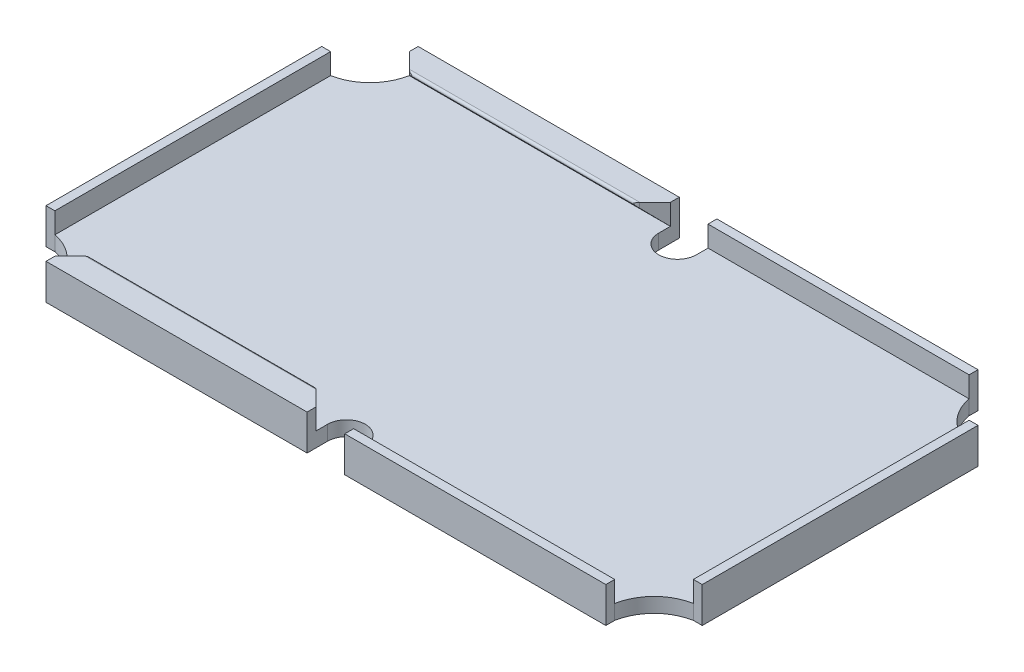
from build123d import *

# Parameters (mm, degrees)
CROQUIS1_W              = 92.4
CROQUIS1_H              = 52.4
SALIENTE_EXTRUIR1_DEPTH = 5
CROQUIS2_W              = 89.9
CROQUIS2_H              = 49.9
CORTAR_EXTRUIR1_DEPTH   = 2.93
CORTAR_EXTRUIR2_START   = -2.07
CORTAR_EXTRUIR2_DEPTH   = 5
CORTAR_EXTRUIR3_START   = -2.07
CORTAR_EXTRUIR3_DEPTH   = 5
SIMETR_A2_START         = -2.07
SIMETR_A2_COPY_1_DEPTH  = 5
SALIENTE_EXTRUIR3_START = -36.764169
SALIENTE_EXTRUIR3_DEPTH = 36.764169
CORTAR_EXTRUIR5_REACH   = 55.193


with BuildPart() as part:
    # Croquis1 → Saliente-Extruir1 (new body)
    with BuildSketch(Plane(origin=(0, 0, 0), x_dir=(1, 0, 0), z_dir=(0, 1, 0))):
        Rectangle(CROQUIS1_W, CROQUIS1_H)
    extrude(amount=SALIENTE_EXTRUIR1_DEPTH)

    # Croquis2 → Cortar-Extruir1 (cut)
    with BuildSketch(Plane(origin=(0, 5, 0), x_dir=(1, 0, 0), z_dir=(0, 1, 0))):
        Rectangle(CROQUIS2_W, CROQUIS2_H)
    extrude(amount=-CORTAR_EXTRUIR1_DEPTH, mode=Mode.SUBTRACT)

    # Croquis3 → Cortar-Extruir2 (cut)
    with BuildSketch(Plane(origin=(0, 2.07, 0), x_dir=(1, 0, 0), z_dir=(0, 1, 0)).offset(CORTAR_EXTRUIR2_START)):
        with BuildLine():
            Line((2.65, -23.31), (2.65, -26.2))
            Line((2.65, -26.2), (-2.65, -26.2))
            Line((-2.65, -26.2), (-2.65, -23.31))
            ThreePointArc((-2.65, -23.31), (0, -20.66), (2.65, -23.31))
        make_face()
    cortar_extruir2 = extrude(amount=CORTAR_EXTRUIR2_DEPTH, mode=Mode.SUBTRACT)

    # Croquis4 → Cortar-Extruir3 (cut)
    with BuildSketch(Plane(origin=(0, 2.07, 0), x_dir=(1, 0, 0), z_dir=(0, 1, 0)).offset(CORTAR_EXTRUIR3_START)):
        with BuildLine():
            Line((-46.2, -19.414169174), (-46.2, -26.2))
            Line((-46.2, -26.2), (-39.414169174, -26.2))
            Line((-39.414169174, -26.2), (-39.414169174, -24.95))
            ThreePointArc((-39.414169174, -24.95), (-41.32096321, -21.32096321), (-44.95, -19.414169174))
            Line((-44.95, -19.414169174), (-46.2, -19.414169174))
        make_face()
    cortar_extruir3 = extrude(amount=CORTAR_EXTRUIR3_DEPTH, mode=Mode.SUBTRACT)

    # Simetría1: Cortar-Extruir3 across plane
    add(cortar_extruir3.mirror(Plane(origin=(0, 0, 0), x_dir=(0, 0, 1), z_dir=(1, 0, 0))), mode=Mode.SUBTRACT)

    # Simetría2: Cortar-Extruir3 across plane
    add(cortar_extruir3.mirror(Plane.XY), mode=Mode.SUBTRACT)

    # Simetría2 copy 1 sketch → Simetría2 copy 1 (cut)
    with BuildSketch(Plane(origin=(0, 2.07, 0), x_dir=(-1, 0, 0), z_dir=(0, 1, 0)).offset(SIMETR_A2_START)):
        with BuildLine():
            Line((-46.2, -19.414169174), (-46.2, -26.2))
            Line((-46.2, -26.2), (-39.414169174, -26.2))
            Line((-39.414169174, -26.2), (-39.414169174, -24.95))
            ThreePointArc((-39.414169174, -24.95), (-41.32096321, -21.32096321), (-44.95, -19.414169174))
            Line((-44.95, -19.414169174), (-46.2, -19.414169174))
        make_face()
    extrude(amount=SIMETR_A2_COPY_1_DEPTH, mode=Mode.SUBTRACT)

    # Simetría3: Cortar-Extruir2 across plane
    add(cortar_extruir2.mirror(Plane.XY), mode=Mode.SUBTRACT)

    # Croquis7 → Saliente-Extruir3 (add)
    with BuildSketch(Plane(origin=(-2.65, 0, 0), x_dir=(0, 0, -1), z_dir=(1, 0, 0)).offset(SALIENTE_EXTRUIR3_START)):
        with BuildLine():
            Line((-24.95, 2.07), (-24.95, 5))
            Line((-24.95, 5), (-22.8, 5))
            ThreePointArc((-22.8, 5), (-22.523509792, 4.816418061), (-22.585410307, 4.490354433))
            Line((-22.585410307, 4.490354433), (-24.95, 2.07))
        make_face()
    saliente_extruir3 = extrude(amount=SALIENTE_EXTRUIR3_DEPTH)

    # Cortar-Extruir5: up to this face of the body (flat: up to its plane)
    cortar_extruir5_end = Plane(part.part.faces().sort_by_distance((21.032084587, 5, 25.575))[0])
    # Croquis8 → Cortar-Extruir5 (cut, up to the picked face)
    with BuildSketch(Plane(origin=(0, 2.07, 0), x_dir=(1, 0, 0), z_dir=(0, 1, 0)), mode=Mode.PRIVATE) as cortar_extruir5_sk1:
        with BuildLine():
            Line((-39.414169174, -24.95), (-37.257062393, -22.792893219))
            ThreePointArc((-37.257062393, -22.792893219), (-36.932639044, -22.576120467), (-36.549955612, -22.5))
            Line((-36.549955612, -22.5), (-5.514213562, -22.5))
            ThreePointArc((-5.514213562, -22.5), (-5.13153013, -22.576120467), (-4.807106781, -22.792893219))
            Line((-4.807106781, -22.792893219), (-2.65, -24.95))
            Line((-2.65, -24.95), (-1.683524182, -24.95))
            Line((-1.683524182, -24.95), (-1.683524182, -18.227572619))
            Line((-1.683524182, -18.227572619), (-40.735830346, -18.227572619))
            Line((-40.735830346, -18.227572619), (-40.735830346, -24.95))
            Line((-40.735830346, -24.95), (-39.414169174, -24.95))
        make_face()
    cortar_extruir5_tool1 = split(extrude(cortar_extruir5_sk1.sketch, amount=CORTAR_EXTRUIR5_REACH, mode=Mode.PRIVATE), bisect_by=cortar_extruir5_end, keep=Keep.BOTH, mode=Mode.PRIVATE)
    cortar_extruir5 = cortar_extruir5_tool1.solids().sort_by(Axis((-21.293277, 2.07, 20.569176), (0, 1, 0)))[0]
    add(cortar_extruir5, mode=Mode.SUBTRACT)

    # Simetría4: Saliente-Extruir3, Cortar-Extruir5 across plane
    add(saliente_extruir3.mirror(Plane.XY))
    add(cortar_extruir5.mirror(Plane.XY), mode=Mode.SUBTRACT)


solid = part.part
